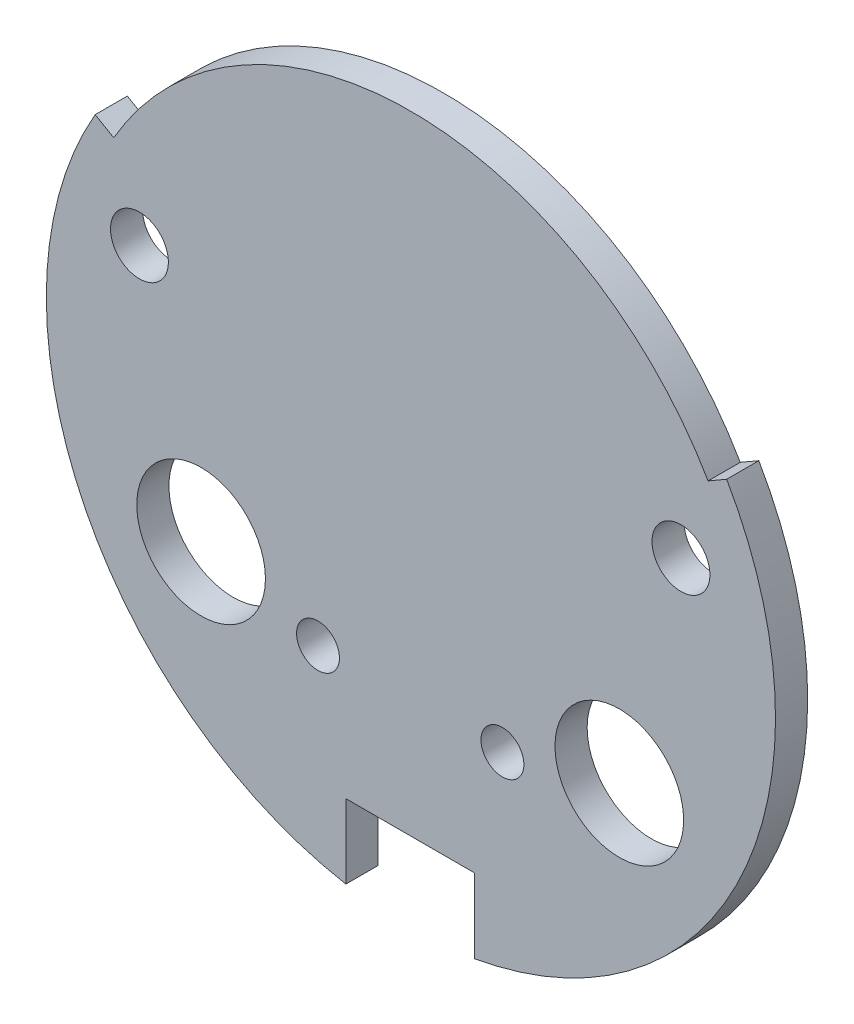
from build123d import *

# Parameters (mm, degrees)
BOSS_EXTRUDE1_DEPTH = 1.5
SKETCH2_R           = 3
SKETCH2_R_2         = 1.35
SKETCH2_R_3         = 1
CUT_EXTRUDE1_DEPTH  = 25.182451908


with BuildPart() as part:
    # Sketch1 → Boss-Extrude1 (new body)
    with BuildSketch(Plane.XY):
        with BuildLine():
            Line((-3.352285907, -12.464521672), (2.647714093, -12.464521672))
            Line((2.647714093, -12.464521672), (2.647714093, -15.928650375))
            ThreePointArc((2.647714093, -15.928650375), (15.091360711, -6.367255259), (14.403401907, 9.310478328))
            Line((14.403401907, 9.310478328), (13.537376503, 8.810478328))
            ThreePointArc((13.537376503, 8.810478328), (-0.319029957, 16.810478328), (-14.175436418, 8.810478328))
            Line((-14.175436418, 8.810478328), (-15.041461822, 9.310478328))
            ThreePointArc((-15.041461822, 9.310478328), (-15.743655386, -6.336614115), (-3.352285907, -15.916725812))
            Line((-3.352285907, -15.916725812), (-3.352285907, -12.464521672))
        make_face()
    extrude(amount=BOSS_EXTRUDE1_DEPTH)

    # Sketch2 → Cut-Extrude1 (cut, through all)
    with BuildSketch(Plane.XY.offset(1.5)):
        with Locations((-10.102285907, -5.464521672)):
            Circle(SKETCH2_R)
        with Locations(Location((9.397714093, -5.464521672, 0), (0, 0, 180))):
            Circle(SKETCH2_R)
        with Locations((-12.977285907, 5.060478328)):
            Circle(SKETCH2_R_2)
        with Locations(Location((12.272714093, 5.060478328, 0), (0, 0, 180))):
            Circle(SKETCH2_R_2)
        with Locations((-4.652285907, -6.939521672)):
            Circle(SKETCH2_R_3)
        with Locations(Location((3.947714093, -6.939521672, 0), (0, 0, 180))):
            Circle(SKETCH2_R_3)
    extrude(amount=-CUT_EXTRUDE1_DEPTH, mode=Mode.SUBTRACT)


solid = part.part
